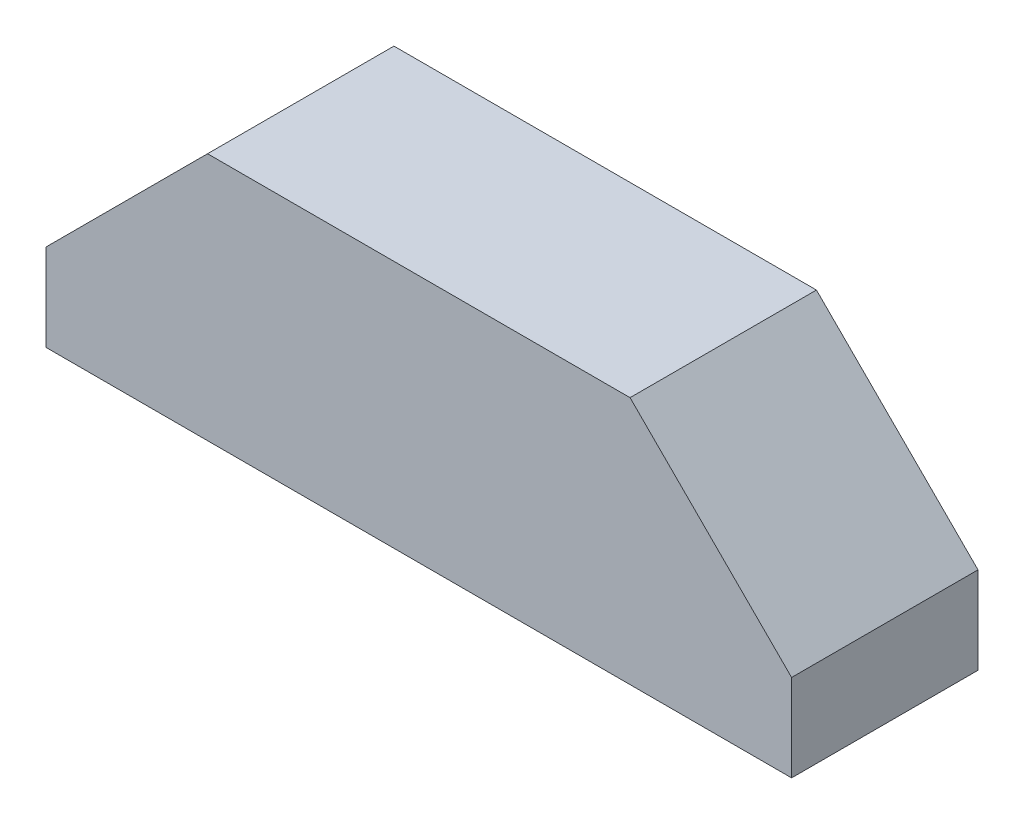
from build123d import *

# Parameters (mm, degrees)
AUFSATZ_LINEAR_AUSTRAGEN1_DEPTH = 3


with BuildPart() as part:
    # Skizze1 → Aufsatz-Linear austragen1 (new body)
    with BuildSketch(Plane.XY):
        Polygon((3.4, 1.808858787), (-3.4, 1.808858787), (-6, -0.791141213), (-6, -2.191141213), (6, -2.191141213), (6, -0.791141213), align=None)
    extrude(amount=AUFSATZ_LINEAR_AUSTRAGEN1_DEPTH)


solid = part.part
